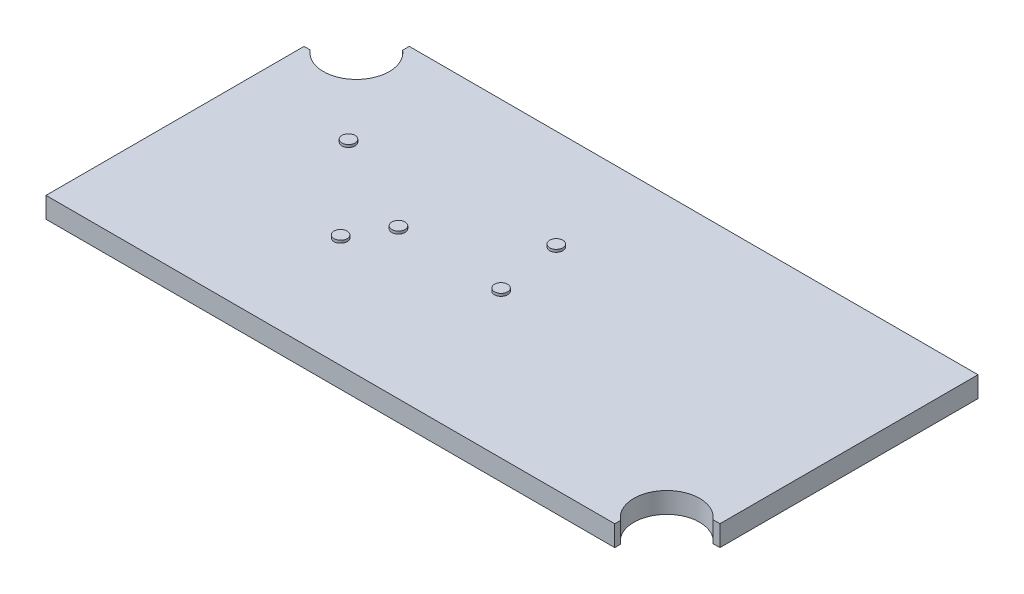
from build123d import *

# Parameters (mm, degrees)
BOSS_EXTRUDE1_DEPTH = 1
SKETCH2_R           = 0.3175
BOSS_EXTRUDE2_DEPTH = 0.127


with BuildPart() as part:
    # Sketch1 → Boss-Extrude1 (new body)
    with BuildSketch(Plane(origin=(0, 0, 0), x_dir=(1, 0, 0), z_dir=(0, 1, 0))):
        with BuildLine():
            Line((-12.46, 7.5), (15, 7.5))
            Line((15, 7.5), (15, -4.96))
            Line((15, -4.96), (14.667795167, -4.96))
            ThreePointArc((14.667795167, -4.96), (12.312776928, -4.866304174), (12.46, -7.218582895))
            Line((12.46, -7.218582895), (12.46, -7.5))
            Line((12.46, -7.5), (-15, -7.5))
            Line((-15, -7.5), (-15, 4.96))
            Line((-15, 4.96), (-14.707321343, 4.96))
            ThreePointArc((-14.707321343, 4.96), (-12.359897737, 4.833074853), (-12.46, 7.181795167))
            Line((-12.46, 7.181795167), (-12.46, 7.5))
        make_face()
    extrude(amount=BOSS_EXTRUDE1_DEPTH)

    # Sketch2 → Boss-Extrude2 (add)
    with BuildSketch(Plane(origin=(0, 1, 0), x_dir=(1, 0, 0), z_dir=(0, 1, 0))):
        with Locations(Location((-9.92, 2.025, 0), (0, 0, 270))):
            Circle(SKETCH2_R)
        with Locations(Location((-5.094, -0.388, 0), (0, 0, 270))):
            Circle(SKETCH2_R)
        with Locations(Location((-6.11, -2.166, 0), (0, 0, 270))):
            Circle(SKETCH2_R)
        with Locations(Location((-0.522, 2.66, 0), (0, 0, 270))):
            Circle(SKETCH2_R)
        with Locations(Location((-0.014, -0.515, 0), (0, 0, 270))):
            Circle(SKETCH2_R)
    extrude(amount=BOSS_EXTRUDE2_DEPTH)


solid = part.part
